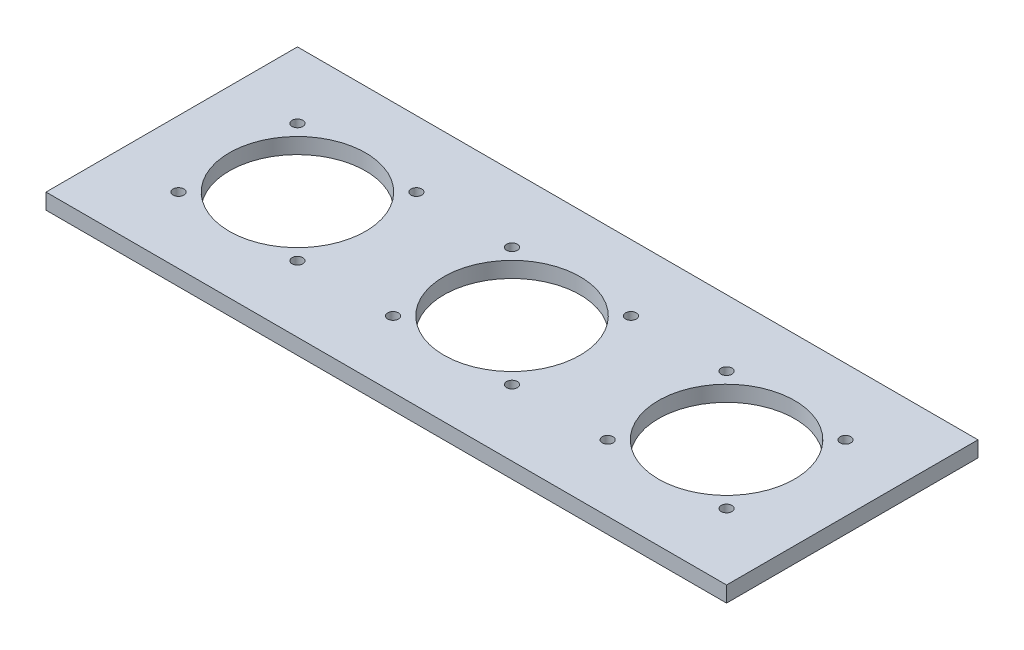
from build123d import *

# Parameters (mm, degrees)
SKETCH1_W                    = 412.496
SKETCH1_H                    = 152.4
BOSS_EXTRUDE1_DEPTH          = 4.7625
CUT_EXTRUDE2_START           = 4.7625
SKETCH2_R                    = 41.275
CUT_EXTRUDE2_DEPTH           = 225.688303193
F_5_16_18_TAPPED_HOLE1_D     = 6.5278
F_5_16_18_TAPPED_HOLE1_DEPTH = 9.525
F_5_16_18_TAPPED_HOLE1_TIP   = 1.961148974
F_5_16_18_TAPPED_HOLE2_D     = 6.5278
F_5_16_18_TAPPED_HOLE2_DEPTH = 9.525
F_5_16_18_TAPPED_HOLE2_TIP   = 1.961148974
F_5_16_18_TAPPED_HOLE3_D     = 6.5278
F_5_16_18_TAPPED_HOLE3_DEPTH = 9.525
F_5_16_18_TAPPED_HOLE3_TIP   = 1.961148974


with BuildPart() as part:
    # Sketch1 → Boss-Extrude1 (new, symmetric)
    with BuildSketch(Plane(origin=(0, 0, 0), x_dir=(1, 0, 0), z_dir=(0, 1, 0))):
        Rectangle(SKETCH1_W, SKETCH1_H)
    extrude(amount=BOSS_EXTRUDE1_DEPTH, both=True)

    # Sketch2 → Cut-Extrude2 (cut, through all)
    with BuildSketch(Plane(origin=(0, 0, 0), x_dir=(1, 0, 0), z_dir=(0, 1, 0)).offset(CUT_EXTRUDE2_START)):
        with Locations(Location((-130.048, 0, 0), (0, 0, 270))):
            Circle(SKETCH2_R)
        with Locations(Location((0, 0, 0), (0, 0, 270))):
            Circle(SKETCH2_R)
        with Locations(Location((130.048, 0, 0), (0, 0, 270))):
            Circle(SKETCH2_R)
    extrude(amount=-CUT_EXTRUDE2_DEPTH, mode=Mode.SUBTRACT)

    # 5/16-18 Tapped Hole1
    with Locations(Plane(origin=(0, 4.7625, 0), x_dir=(1, 0, 0), z_dir=(0, 1, 0))):
        with Locations((-166.0906, -36.0426), (-94.0054, -36.0426), (-166.0906, 36.0426), (-94.0054, 36.0426)):
            Hole(F_5_16_18_TAPPED_HOLE1_D / 2, depth=F_5_16_18_TAPPED_HOLE1_DEPTH)
            with Locations((0, 0, -(F_5_16_18_TAPPED_HOLE1_DEPTH + F_5_16_18_TAPPED_HOLE1_TIP / 2))):  # 118° drill point
                Cone(0, F_5_16_18_TAPPED_HOLE1_D / 2, F_5_16_18_TAPPED_HOLE1_TIP, mode=Mode.SUBTRACT)

    # 5/16-18 Tapped Hole2
    with Locations(Plane(origin=(0, 4.7625, 0), x_dir=(1, 0, 0), z_dir=(0, 1, 0))):
        with Locations((-36.0426, -36.0426), (36.0426, -36.0426), (-36.0426, 36.0426), (36.0426, 36.0426)):
            Hole(F_5_16_18_TAPPED_HOLE2_D / 2, depth=F_5_16_18_TAPPED_HOLE2_DEPTH)
            with Locations((0, 0, -(F_5_16_18_TAPPED_HOLE2_DEPTH + F_5_16_18_TAPPED_HOLE2_TIP / 2))):  # 118° drill point
                Cone(0, F_5_16_18_TAPPED_HOLE2_D / 2, F_5_16_18_TAPPED_HOLE2_TIP, mode=Mode.SUBTRACT)

    # 5/16-18 Tapped Hole3
    with Locations(Plane(origin=(0, 4.7625, 0), x_dir=(1, 0, 0), z_dir=(0, 1, 0))):
        with Locations((94.0054, -36.0426), (166.0906, -36.0426), (94.0054, 36.0426), (166.0906, 36.0426)):
            Hole(F_5_16_18_TAPPED_HOLE3_D / 2, depth=F_5_16_18_TAPPED_HOLE3_DEPTH)
            with Locations((0, 0, -(F_5_16_18_TAPPED_HOLE3_DEPTH + F_5_16_18_TAPPED_HOLE3_TIP / 2))):  # 118° drill point
                Cone(0, F_5_16_18_TAPPED_HOLE3_D / 2, F_5_16_18_TAPPED_HOLE3_TIP, mode=Mode.SUBTRACT)


solid = part.part
